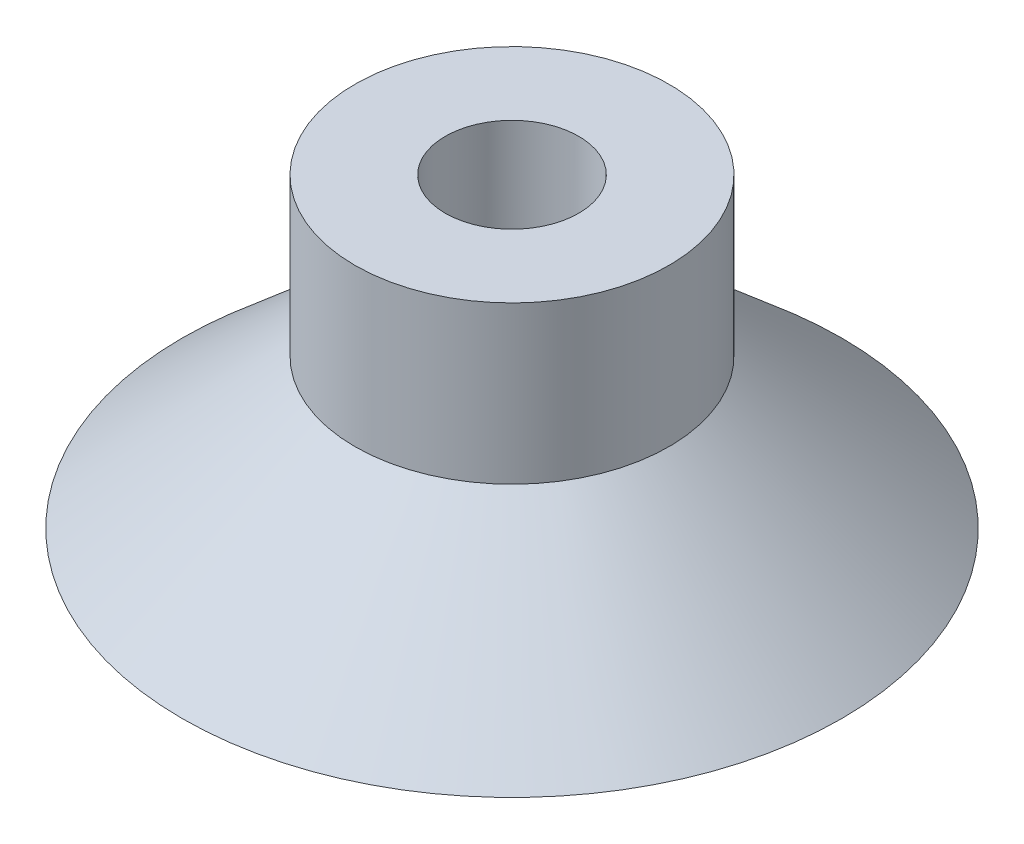
from build123d import *

# Parameters (mm, degrees)
M10_TAPPED_HOLE1_D     = 8.5
M10_TAPPED_HOLE1_DEPTH = 24.5
M10_TAPPED_HOLE1_TIP   = 2.553657631


with BuildPart() as part:
    # Sketch1 → Revolve1 (revolve)
    with BuildSketch(Plane.XY, mode=Mode.PRIVATE) as revolve1_sk:
        Polygon((0, 0), (21, 0), (10, 9.5), (10, 19.5), (0, 19.5), align=None)
    revolve(revolve1_sk.sketch.rotate(Axis((0, 59.431666947, 0), (0, -1, 0)), 90), axis=Axis((0, 59.431666947, 0), (0, -1, 0)))

    # Sketch2 → Cut-Revolve1 (revolve, cut)
    with BuildSketch(Plane.XY, mode=Mode.PRIVATE) as cut_revolve1_sk:
        Polygon((0, 8), (10.971871481, 8), (20.235029376, 0), (0, 0), align=None)
    revolve(cut_revolve1_sk.sketch.rotate(Axis((0, 26.152643853, 0), (0, -1, 0)), 90), axis=Axis((0, 26.152643853, 0), (0, -1, 0)), mode=Mode.SUBTRACT)

    # M10 Tapped Hole1
    with Locations(Plane(origin=(0, 19.5, 0), x_dir=(1, 0, 0), z_dir=(0, 1, 0))):
        with Locations((0, 0)):
            Hole(M10_TAPPED_HOLE1_D / 2, depth=M10_TAPPED_HOLE1_DEPTH)
            with Locations((0, 0, -(M10_TAPPED_HOLE1_DEPTH + M10_TAPPED_HOLE1_TIP / 2))):  # 118° drill point
                Cone(0, M10_TAPPED_HOLE1_D / 2, M10_TAPPED_HOLE1_TIP, mode=Mode.SUBTRACT)


solid = part.part
